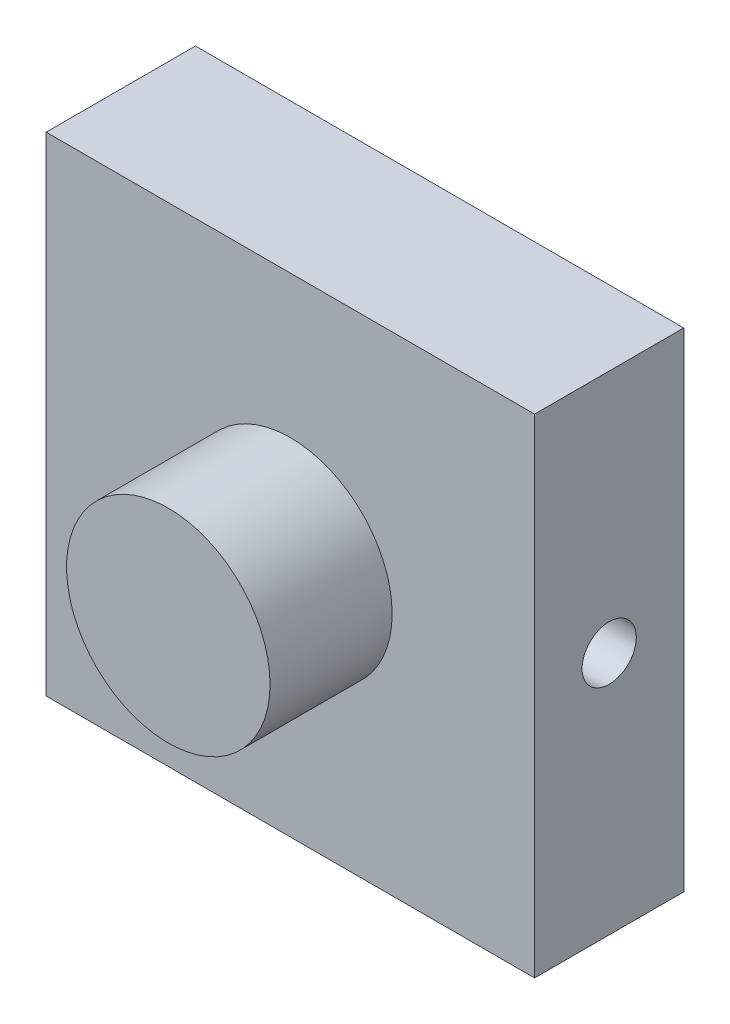
from build123d import *

# Parameters (mm, degrees)
SKETCH_1_W          = 36
SKETCH_1_H          = 36
SKETCH_1_R          = 7.5
EXTRUDE_1_DEPTH     = 11
EXTRUDE_START       = 11
SKETCH_1_3_R        = 7.5
EXTRUDE_2_DEPTH     = 9
SKETCH_2_R          = 2
CUT_EXTRUDE_1_DEPTH = 3
CUT_EXTRUDE_START   = -33
SKETCH_2_2_R        = 2
CUT_EXTRUDE_2_DEPTH = 3


with BuildPart() as part:
    # 草图1 → 凸台-拉伸1 (new body)
    # profile 1 of 2: a face of its own
    with BuildSketch(Plane.XY):
        with Locations((18, 18)):
            Rectangle(SKETCH_1_W, SKETCH_1_H)
        with Locations((18, 18)):
            Circle(SKETCH_1_R, mode=Mode.SUBTRACT)
    # profile 2 of 2: a face of its own
    with BuildSketch(Plane.XY):
        with Locations((18, 18)):
            Circle(SKETCH_1_R)
    extrude(amount=EXTRUDE_1_DEPTH)

    # 草图1<3> → 凸台-拉伸2 (add)
    with BuildSketch(Plane.XY.offset(EXTRUDE_START)):
        with Locations((18, 18)):
            Circle(SKETCH_1_3_R)
    extrude(amount=EXTRUDE_2_DEPTH)

    # 草图2 → 切除-拉伸1 (cut)
    with BuildSketch(Plane(origin=(36, 0, 0), x_dir=(0, 0, -1), z_dir=(1, 0, 0))):
        with Locations((-5.5, 18)):
            Circle(SKETCH_2_R)
    extrude(amount=-CUT_EXTRUDE_1_DEPTH, mode=Mode.SUBTRACT)

    # 草图2<2> → 切除-拉伸2 (cut)
    with BuildSketch(Plane(origin=(36, 0, 0), x_dir=(0, 0, -1), z_dir=(1, 0, 0)).offset(CUT_EXTRUDE_START)):
        with Locations((-5.5, 18)):
            Circle(SKETCH_2_2_R)
    extrude(amount=-CUT_EXTRUDE_2_DEPTH, mode=Mode.SUBTRACT)


solid = part.part
